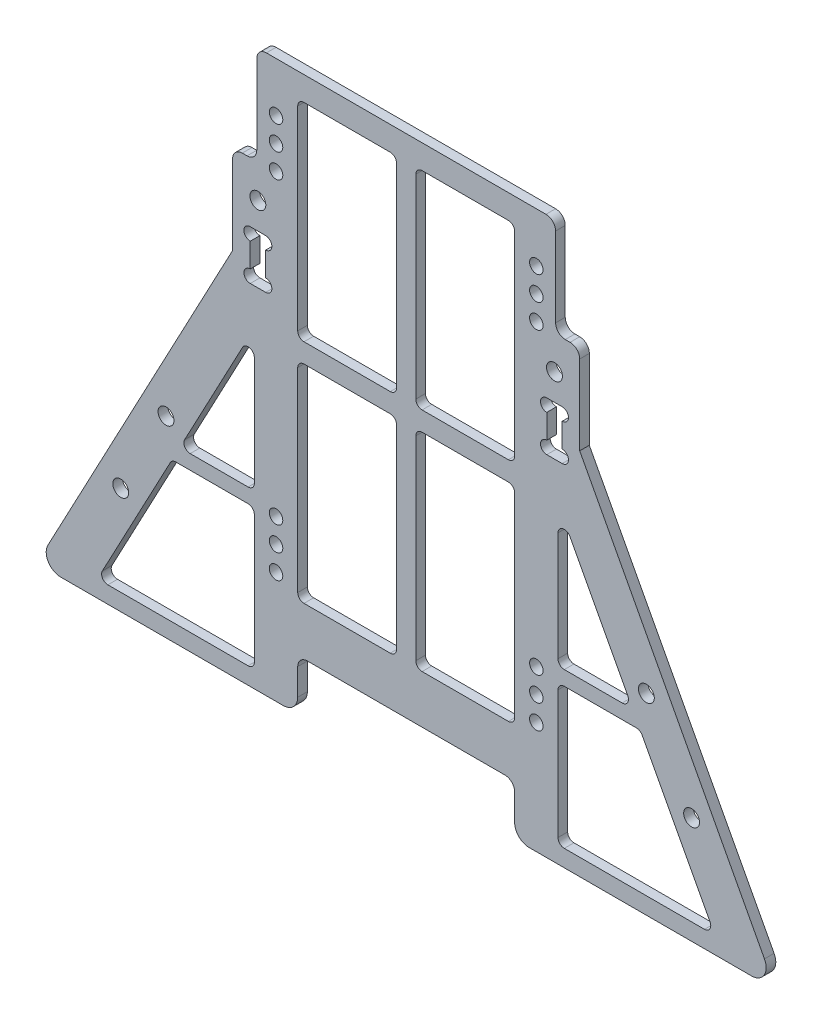
from build123d import *

# Parameters (mm, degrees)
SKETCH_1_W             = 72
SKETCH_1_H             = 150
EXTRUDE_1_DEPTH        = 1
SKETCH_2_R             = 1.4
CUT_EXTRUDE_1_DEPTH    = 2
PATTERN_LINEAR_1_COUNT = 2
PATTERN_LINEAR_1_PITCH = 5
PATTERN_LINEAR_2_COUNT = 2
PATTERN_LINEAR_2_PITCH = 5
SKETCH_9_W             = 72
SKETCH_9_H             = 7.5
CUT_EXTRUDE_4_DEPTH    = 5.5
EXTRUDE_5_DEPTH        = 2
SKETCH_12_W            = 72
SKETCH_12_H            = 48.96667592
CUT_EXTRUDE_5_DEPTH    = 10
SKETCH_14_R            = 1.65
CUT_EXTRUDE_6_DEPTH    = 10
SKETCH_15_W            = 3.2
SKETCH_15_H            = 10.2
CUT_EXTRUDE_7_DEPTH    = 10
SKETCH_16_R            = 1.3
CUT_EXTRUDE_8_DEPTH    = 10
SKETCH_17_R            = 1.65
CUT_EXTRUDE_9_DEPTH    = 10
FILLET_1_R             = 2
SKETCH_18_W            = 20.5
SKETCH_18_H            = 43
CUT_EXTRUDE_10_DEPTH   = 10
CUT_EXTRUDE_11_DEPTH   = 10
FILLET_2_R             = 1.3
SKETCH_20_W            = 45
SKETCH_20_H            = 26.033324079
CUT_EXTRUDE_12_DEPTH   = 10
FILLET_3_R             = 2
SKETCH_21_W            = 5
SKETCH_21_H            = 20.5
CUT_EXTRUDE_13_DEPTH   = 10
FILLET_4_R             = 2
SKETCH_22_W            = 156
SKETCH_22_H            = 2.5
CUT_EXTRUDE_14_DEPTH   = 109.226614102
FILLET_5_R             = 3


with BuildPart() as part:
    # 草图1 → 凸台-拉伸1 (new, symmetric)
    with BuildSketch(Plane.XY):
        Rectangle(SKETCH_1_W, SKETCH_1_H)
    extrude(amount=EXTRUDE_1_DEPTH, both=True)

    # 草图2 → 切除-拉伸1 (cut)
    with BuildSketch(Plane(origin=(0, 0, -1), x_dir=(-1, 0, 0), z_dir=(0, 0, -1))):
        with Locations((-27, -12.3)):
            Circle(SKETCH_2_R)
        with Locations((27, -12.3)):
            Circle(SKETCH_2_R)
        with Locations((27, 59.7)):
            Circle(SKETCH_2_R)
        with Locations((-27, 59.7)):
            Circle(SKETCH_2_R)
    cut_extrude_1 = extrude(amount=-CUT_EXTRUDE_1_DEPTH, mode=Mode.SUBTRACT)

    # 阵列(线性)1: 切除-拉伸1 ×2
    with Locations(*[(0, -i * PATTERN_LINEAR_1_PITCH, 0) for i in range(1, PATTERN_LINEAR_1_COUNT)]):
        add(cut_extrude_1, mode=Mode.SUBTRACT)

    # 阵列(线性)2: 切除-拉伸1 ×2
    with Locations(*[(0, i * PATTERN_LINEAR_2_PITCH, 0) for i in range(1, PATTERN_LINEAR_2_COUNT)]):
        add(cut_extrude_1, mode=Mode.SUBTRACT)

    # 草图9 → 切除-拉伸4 (cut)
    with BuildSketch(Plane.XY.offset(1)):
        with Locations((0, -71.25)):
            Rectangle(SKETCH_9_W, SKETCH_9_H)
    extrude(amount=-CUT_EXTRUDE_4_DEPTH, mode=Mode.SUBTRACT)

    # 草图11 → 凸台-拉伸5 (add)
    with BuildSketch(Plane(origin=(0, 0, -1), x_dir=(-1, 0, 0), z_dir=(0, 0, -1))):
        Polygon((-36, 36), (-78, -43.01666204), (-36, -43.01666204), align=None)
        Polygon((36, -43.01666204), (36, 36), (78, -43.01666204), align=None)
    extrude(amount=-EXTRUDE_5_DEPTH)

    # 草图12 → 切除-拉伸5 (cut)
    with BuildSketch(Plane.XY.offset(1)):
        with Locations((0, -67.5)):
            Rectangle(SKETCH_12_W, SKETCH_12_H)
    extrude(amount=-CUT_EXTRUDE_5_DEPTH, mode=Mode.SUBTRACT)

    # 草图14 → 切除-拉伸6 (cut)
    with BuildSketch(Plane(origin=(0, 0, -1), x_dir=(-1, 0, 0), z_dir=(0, 0, -1))):
        with Locations((-49.82296811, -0.658849754)):
            Circle(SKETCH_14_R)
        with Locations((-59.209976564, -18.319089624)):
            Circle(SKETCH_14_R)
        with Locations((49.82296811, -0.658849754)):
            Circle(SKETCH_14_R)
        with Locations((59.209976564, -18.319089624)):
            Circle(SKETCH_14_R)
    extrude(amount=-CUT_EXTRUDE_6_DEPTH, mode=Mode.SUBTRACT)

    # 草图15 → 切除-拉伸7 (cut)
    with BuildSketch(Plane(origin=(0, 0, -1), x_dir=(-1, 0, 0), z_dir=(0, 0, -1))):
        with Locations((30.75, 37)):
            Rectangle(SKETCH_15_W, SKETCH_15_H)
        with Locations((-30.7673157, 37)):
            Rectangle(SKETCH_15_W, SKETCH_15_H)
    extrude(amount=-CUT_EXTRUDE_7_DEPTH, mode=Mode.SUBTRACT)

    # 草图16 → 切除-拉伸8 (cut)
    with BuildSketch(Plane(origin=(0, 0, -1), x_dir=(-1, 0, 0), z_dir=(0, 0, -1))):
        with Locations((-29.1673157, 40.8)):
            Circle(SKETCH_16_R)
        with Locations((-32.3673157, 40.8)):
            Circle(SKETCH_16_R)
        with Locations((-32.3673157, 33.2)):
            Circle(SKETCH_16_R)
        with Locations((-29.1673157, 33.2)):
            Circle(SKETCH_16_R)
        with Locations((29.1673157, 33.2)):
            Circle(SKETCH_16_R)
        with Locations((32.3673157, 33.2)):
            Circle(SKETCH_16_R)
        with Locations((32.3673157, 40.8)):
            Circle(SKETCH_16_R)
        with Locations((29.1673157, 40.8)):
            Circle(SKETCH_16_R)
    extrude(amount=-CUT_EXTRUDE_8_DEPTH, mode=Mode.SUBTRACT)

    # 草图17 → 切除-拉伸9 (cut)
    with BuildSketch(Plane(origin=(0, 0, -1), x_dir=(-1, 0, 0), z_dir=(0, 0, -1))):
        with Locations((-30.7673157, 47.6)):
            Circle(SKETCH_17_R)
        with Locations((30.7673157, 47.6)):
            Circle(SKETCH_17_R)
    extrude(amount=-CUT_EXTRUDE_9_DEPTH, mode=Mode.SUBTRACT)

    # 圆角1
    fillet_1_edges = [part.edges().sort_by_distance(p)[0] for p in [
        (-36, 75, 0),
        (36, 75, 0),
    ]]
    fillet(fillet_1_edges, radius=FILLET_1_R)

    # 草图18 → 切除-拉伸10 (cut)
    with BuildSketch(Plane(origin=(0, 0, -1), x_dir=(-1, 0, 0), z_dir=(0, 0, -1))):
        with Locations((12.25, 48.5)):
            Rectangle(SKETCH_18_W, SKETCH_18_H)
        with Locations((-12.25, 48.5)):
            Rectangle(SKETCH_18_W, SKETCH_18_H)
        with Locations((-12.25, 1.5)):
            Rectangle(SKETCH_18_W, SKETCH_18_H)
        with Locations((12.25, 1.5)):
            Rectangle(SKETCH_18_W, SKETCH_18_H)
    extrude(amount=-CUT_EXTRUDE_10_DEPTH, mode=Mode.SUBTRACT)

    # 草图19 → 切除-拉伸11 (cut)
    with BuildSketch(Plane(origin=(0, 0, -1), x_dir=(-1, 0, 0), z_dir=(0, 0, -1))):
        Polygon((-31.5, -7.895665687), (-48.573384423, -7.895665687), (-64.052168457, -37.01666204), (-31.5, -37.01666204), align=None)
        Polygon((-31.5, 24.225330666), (-46.978784034, -4.895665687), (-31.5, -4.895665687), align=None)
        Polygon((31.5, 24.225330666), (31.5, -4.895665687), (46.978784034, -4.895665687), align=None)
        Polygon((48.573384423, -7.895665687), (31.5, -7.895665687), (31.5, -37.01666204), (64.052168457, -37.01666204), align=None)
    extrude(amount=-CUT_EXTRUDE_11_DEPTH, mode=Mode.SUBTRACT)

    # 圆角2
    fillet_2_edges = [part.edges().sort_by_distance(p)[0] for p in [
        (-2, 23, 0),
        (-22.5, 23, 0),
        (-22.5, -20, 0),
        (-2, -20, 0),
        (2, 23, 0),
        (2, -20, 0),
        (22.5, -20, 0),
        (22.5, 23, 0),
        (2, 70, 0),
        (2, 27, 0),
        (22.5, 27, 0),
        (22.5, 70, 0),
        (-2, 70, 0),
        (-22.5, 70, 0),
        (-22.5, 27, 0),
        (-2, 27, 0),
        (-48.573384423, -7.895665687, 0),
        (-64.052168457, -37.01666204, 0),
        (-31.5, -37.01666204, 0),
        (-31.5, -7.895665687, 0),
        (-31.5, 24.225330666, 0),
        (-46.978784034, -4.895665687, 0),
        (-31.5, -4.895665687, 0),
        (31.5, -4.895665687, 0),
        (46.978784034, -4.895665687, 0),
        (31.5, 24.225330666, 0),
        (31.5, -7.895665687, 0),
        (31.5, -37.01666204, 0),
        (64.052168457, -37.01666204, 0),
        (48.573384423, -7.895665687, 0),
    ]]
    fillet(fillet_2_edges, radius=FILLET_2_R)

    # 草图20 → 切除-拉伸12 (cut)
    with BuildSketch(Plane(origin=(0, 0, -1), x_dir=(-1, 0, 0), z_dir=(0, 0, -1))):
        with Locations((0, -43.01666204)):
            Rectangle(SKETCH_20_W, SKETCH_20_H)
    extrude(amount=-CUT_EXTRUDE_12_DEPTH, mode=Mode.SUBTRACT)

    # 圆角3
    fillet_3_edges = [part.edges().sort_by_distance(p)[0] for p in [
        (22.5, -30, 0),
        (-22.5, -30, 0),
    ]]
    fillet(fillet_3_edges, radius=FILLET_3_R)

    # 草图21 → 切除-拉伸13 (cut)
    with BuildSketch(Plane(origin=(0, 0, -1), x_dir=(-1, 0, 0), z_dir=(0, 0, -1))):
        with Locations((-33.5, 64.75)):
            Rectangle(SKETCH_21_W, SKETCH_21_H)
        with Locations((33.5, 64.75)):
            Rectangle(SKETCH_21_W, SKETCH_21_H)
    extrude(amount=-CUT_EXTRUDE_13_DEPTH, mode=Mode.SUBTRACT)

    # 圆角4
    fillet_4_edges = [part.edges().sort_by_distance(p)[0] for p in [
        (31, 54.5, 0),
        (31, 75, 0),
        (36, 54.5, 0),
        (-36, 54.5, 0),
        (-31, 54.5, 0),
        (-31, 75, 0),
    ]]
    fillet(fillet_4_edges, radius=FILLET_4_R)

    # 草图22 → 切除-拉伸14 (cut, through all)
    with BuildSketch(Plane(origin=(0, 0, -1), x_dir=(-1, 0, 0), z_dir=(0, 0, -1))):
        with Locations((0, -41.76666204)):
            Rectangle(SKETCH_22_W, SKETCH_22_H)
    extrude(amount=-CUT_EXTRUDE_14_DEPTH, mode=Mode.SUBTRACT)

    # 圆角5
    fillet_5_edges = [part.edges().sort_by_distance(p)[0] for p in [
        (22.5, -40.51666204, 0),
        (76.671166343, -40.51666204, 0),
        (-76.671166343, -40.51666204, 0),
        (-22.5, -40.51666204, 0),
    ]]
    fillet(fillet_5_edges, radius=FILLET_5_R)


solid = part.part
